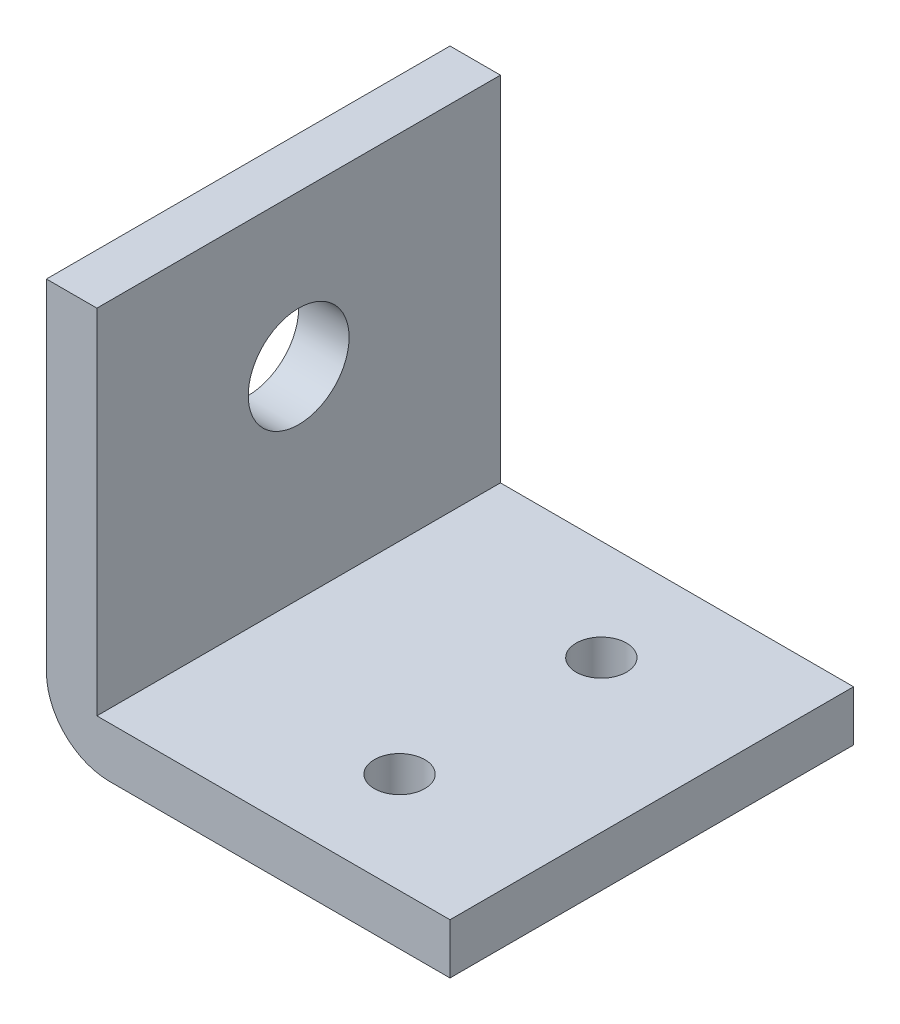
from build123d import *

# Parameters (mm, degrees)
BOSS_EXTRUDE1_DEPTH    = 20
FILLET1_R              = 6.25
F_10_0MM_DOWEL_HOLE1_D = 10
F_5_0MM_DOWEL_HOLE1_D  = 5


with BuildPart() as part:
    # Sketch1 → Boss-Extrude1 (new, symmetric)
    with BuildSketch(Plane.XY):
        Polygon((0, 40), (0, 0), (40, 0), (40, 5), (5, 5), (5, 40), align=None)
    extrude(amount=BOSS_EXTRUDE1_DEPTH, both=True)

    # Fillet1
    fillet1_edges = [part.edges().sort_by_distance(p)[0] for p in [
        (0, 0, 0),
    ]]
    fillet(fillet1_edges, radius=FILLET1_R)

    # Ø10.0mm Dowel Hole1 (through all)
    with Locations(Plane(origin=(5, 0, 0), x_dir=(0, 0, -1), z_dir=(1, 0, 0))):
        with Locations((0, 25)):
            Hole(F_10_0MM_DOWEL_HOLE1_D / 2)

    # Ø5.0mm Dowel Hole1 (through all)
    with Locations(Plane(origin=(0, 5, 0), x_dir=(1, 0, 0), z_dir=(0, 1, 0))):
        with Locations((25, -10), (25, 10)):
            Hole(F_5_0MM_DOWEL_HOLE1_D / 2)


solid = part.part
